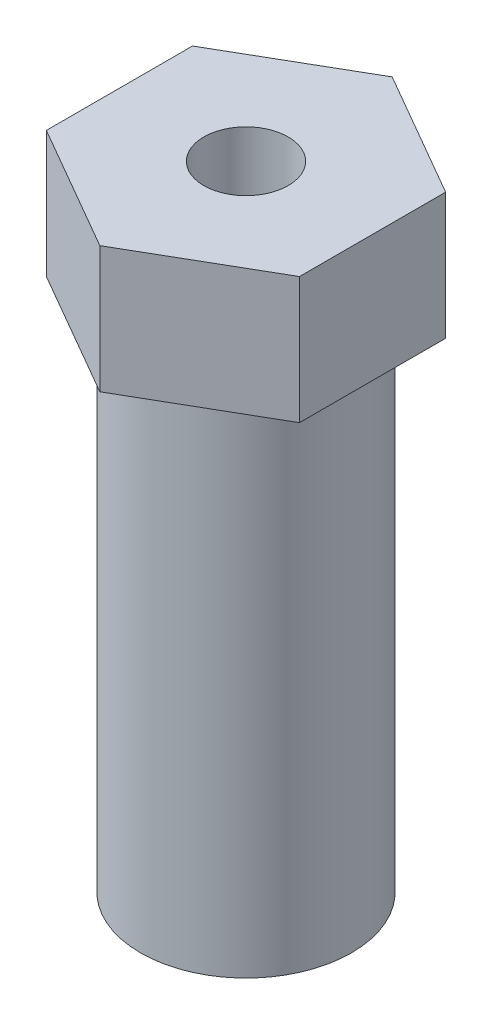
from build123d import *

# Parameters (mm, degrees)
SKETCH_1_R      = 5
SKETCH_1_R_2    = 2.5
EXTRUDE_1_DEPTH = 30
SKETCH_2_R      = 2
EXTRUDE_2_DEPTH = 6


with BuildPart() as part:
    # 草图1 → 凸台-拉伸1 (new body)
    with BuildSketch(Plane(origin=(0, 0, 0), x_dir=(1, 0, 0), z_dir=(0, 1, 0))):
        with Locations(Location((0, 0, 0), (0, 0, 270))):
            Circle(SKETCH_1_R)
        with Locations(Location((0, 0, 0), (0, 0, 270))):
            Circle(SKETCH_1_R_2, mode=Mode.SUBTRACT)
    extrude(amount=EXTRUDE_1_DEPTH)

    # 草图2 → 凸台-拉伸2 (add)
    with BuildSketch(Plane(origin=(0, 30, 0), x_dir=(1, 0, 0), z_dir=(0, 1, 0))):
        Polygon((0, 6.92820323), (-6, 3.464101615), (-6, -3.464101615), (0, -6.92820323), (6, -3.464101615), (6, 3.464101615), align=None)
        with Locations(Location((0, 0, 0), (0, 0, 270))):
            Circle(SKETCH_2_R, mode=Mode.SUBTRACT)
    extrude(amount=-EXTRUDE_2_DEPTH)


solid = part.part
